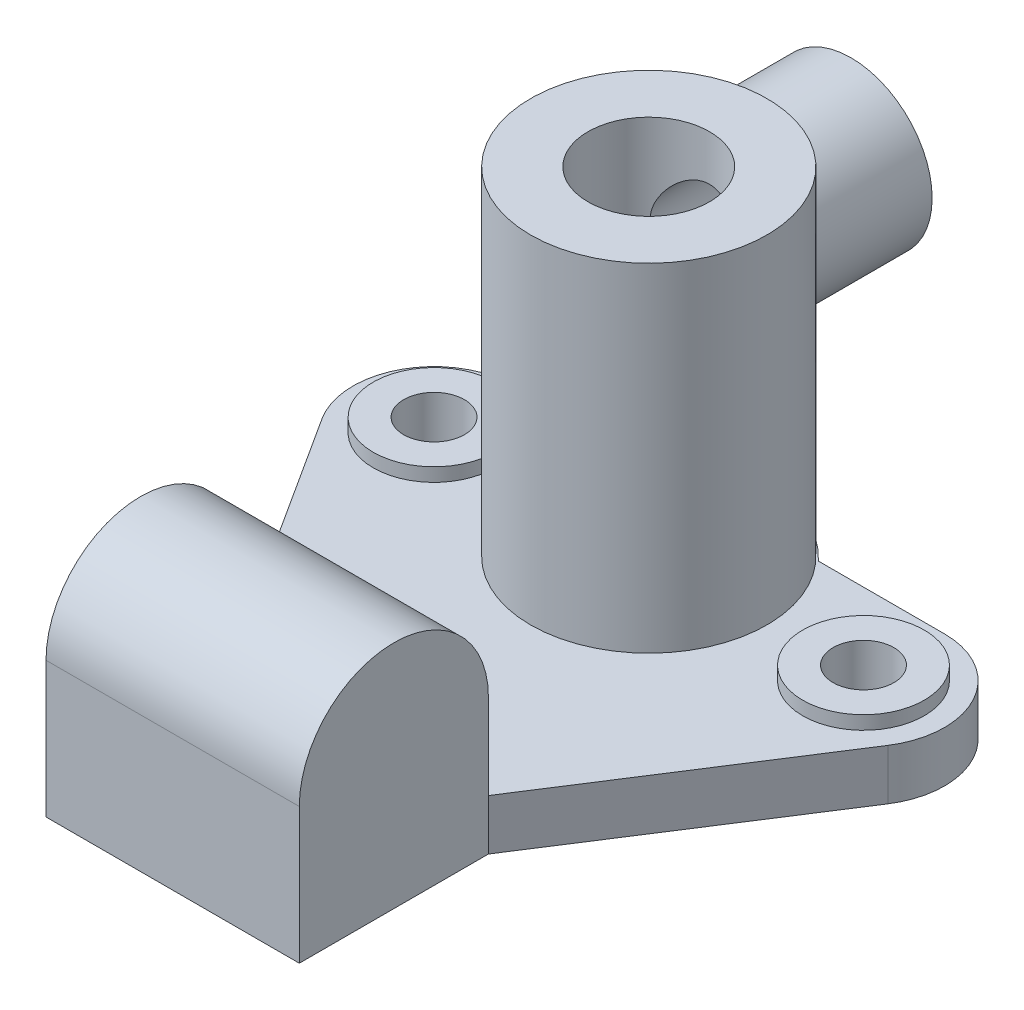
from build123d import *

# Parameters (mm, degrees)
BOSS_EXTRUDE1_DEPTH       = 15
BOSS_EXTRUDE2_DEPTH       = 37.5
SKETCH8_R                 = 35
SKETCH8_R_2               = 18
BOSS_EXTRUDE13_DEPTH      = 100
CUT_EXTRUDE2_START        = -100
SKETCH13_R                = 18
CUT_EXTRUDE2_DEPTH        = 100
SKETCH14_R                = 18
SKETCH14_R_2              = 9
BOSS_EXTRUDE15_DEPTH      = 4
CUT_EXTRUDE3_START        = -50
SKETCH15_R                = 9
CUT_EXTRUDE3_DEPTH        = 50
BOSS_EXTRUDE16_REACH      = 249.48
BOSS_EXTRUDE16_END_RADIUS = 35
SKETCH18_R                = 24
SKETCH19_R                = 12.5
CUT_EXTRUDE4_DEPTH        = 50


with BuildPart() as part:
    # Sketch5 → Boss-Extrude1 (new body)
    with BuildSketch(Plane(origin=(0, 0, 0), x_dir=(1, 0, 0), z_dir=(0, 1, 0))):
        with BuildLine():
            Line((-37.5, -7.876252255), (-83.769584953, 64.123747745))
            ThreePointArc((-83.769584953, 64.123747745), (-84.643426785, 88.600912666), (-63.579244399, 101.098729377))
            Line((-63.579244399, 101.098729377), (-26.201026839, 101.098729377))
            ThreePointArc((-26.201026839, 101.098729377), (0, 112.630318244), (26.201026839, 101.098729377))
            Line((26.201026839, 101.098729377), (63.579244399, 101.098729377))
            ThreePointArc((63.579244399, 101.098729377), (84.643426785, 88.600912666), (83.769584953, 64.123747745))
            Line((83.769584953, 64.123747745), (37.5, -7.876252255))
            Line((37.5, -7.876252255), (-37.5, -7.876252255))
        make_face()
    extrude(amount=BOSS_EXTRUDE1_DEPTH)

    # Sketch7 → Boss-Extrude2 (add, symmetric)
    with BuildSketch(Plane(origin=(0, 0, 0), x_dir=(0, 0, -1), z_dir=(1, 0, 0))):
        with BuildLine():
            Line((-7.876252255, 0), (-63.876252255, 0))
            Line((-63.876252255, 0), (-63.876252255, 40.190310044))
            ThreePointArc((-63.876252255, 40.190310044), (-35.876252255, 68.190310044), (-7.876252255, 40.190310044))
            Line((-7.876252255, 40.190310044), (-7.876252255, 0))
        make_face()
    extrude(amount=BOSS_EXTRUDE2_DEPTH, both=True)

    # Sketch8 → Boss-Extrude13 (add)
    with BuildSketch(Plane(origin=(0, 15, 0), x_dir=(1, 0, 0), z_dir=(0, 1, 0))):
        with Locations(Location((0, 77.098729377, 0), (0, 0, 90))):
            Circle(SKETCH8_R)
        with Locations(Location((0, 77.098729377, 0), (0, 0, 90))):
            Circle(SKETCH8_R_2, mode=Mode.SUBTRACT)
    extrude(amount=BOSS_EXTRUDE13_DEPTH)

    # Sketch13 → Cut-Extrude2 (cut)
    with BuildSketch(Plane(origin=(0, 15, 0), x_dir=(1, 0, 0), z_dir=(0, 1, 0)).offset(CUT_EXTRUDE2_START)):
        with Locations(Location((0, 77.098729377, 0), (0, 0, 90))):
            Circle(SKETCH13_R)
    extrude(amount=CUT_EXTRUDE2_DEPTH, mode=Mode.SUBTRACT)

    # Sketch14 → Boss-Extrude15 (add)
    # profile 1 of 2: a face of its own
    with BuildSketch(Plane(origin=(0, 15, 0), x_dir=(1, 0, 0), z_dir=(0, 1, 0))):
        with Locations(Location((-63.579244399, 77.098729377, 0), (0, 0, 270))):
            Circle(SKETCH14_R)
        with Locations(Location((-63.579244399, 77.098729377, 0), (0, 0, 270))):
            Circle(SKETCH14_R_2, mode=Mode.SUBTRACT)
    # profile 2 of 2: a face of its own
    with BuildSketch(Plane(origin=(0, 15, 0), x_dir=(1, 0, 0), z_dir=(0, 1, 0))):
        with Locations(Location((63.579244399, 77.098729377, 0), (0, 0, 270))):
            Circle(SKETCH14_R)
        with Locations(Location((63.579244399, 77.098729377, 0), (0, 0, 270))):
            Circle(SKETCH14_R_2, mode=Mode.SUBTRACT)
    extrude(amount=BOSS_EXTRUDE15_DEPTH)

    # Sketch15 → Cut-Extrude3 (cut)
    with BuildSketch(Plane(origin=(0, 15, 0), x_dir=(1, 0, 0), z_dir=(0, 1, 0)).offset(CUT_EXTRUDE3_START)):
        with Locations(Location((-63.579244399, 77.098729377, 0), (0, 0, 270))):
            Circle(SKETCH15_R)
        with Locations(Location((63.579244399, 77.098729377, 0), (0, 0, 270))):
            Circle(SKETCH15_R)
    extrude(amount=CUT_EXTRUDE3_DEPTH, mode=Mode.SUBTRACT)

    # Boss-Extrude16: up to this cylinder (the profile starts outside it)
    boss_extrude16_end = Plane(origin=(0, 89, -77.098729377), z_dir=(0, -1, 0)) * Cylinder(BOSS_EXTRUDE16_END_RADIUS, 569.96, mode=Mode.PRIVATE)
    # Sketch18 → Boss-Extrude16 (add, up to the surface)
    with BuildSketch(Plane.XY.offset(-137), mode=Mode.PRIVATE) as boss_extrude16_sk1:
        with Locations(Location((0, 89, 0), (0, 0, 90))):
            Circle(SKETCH18_R)
    boss_extrude16_tool1 = extrude(boss_extrude16_sk1.sketch, amount=BOSS_EXTRUDE16_REACH, mode=Mode.PRIVATE) - boss_extrude16_end
    add(boss_extrude16_tool1.solids().sort_by_distance((0, 89, -137))[0])

    # Sketch19 → Cut-Extrude4 (cut)
    with BuildSketch(Plane(origin=(0, 0, -137), x_dir=(-1, 0, 0), z_dir=(0, 0, -1))):
        with Locations((0, 89)):
            Circle(SKETCH19_R)
    extrude(amount=-CUT_EXTRUDE4_DEPTH, mode=Mode.SUBTRACT)


solid = part.part
